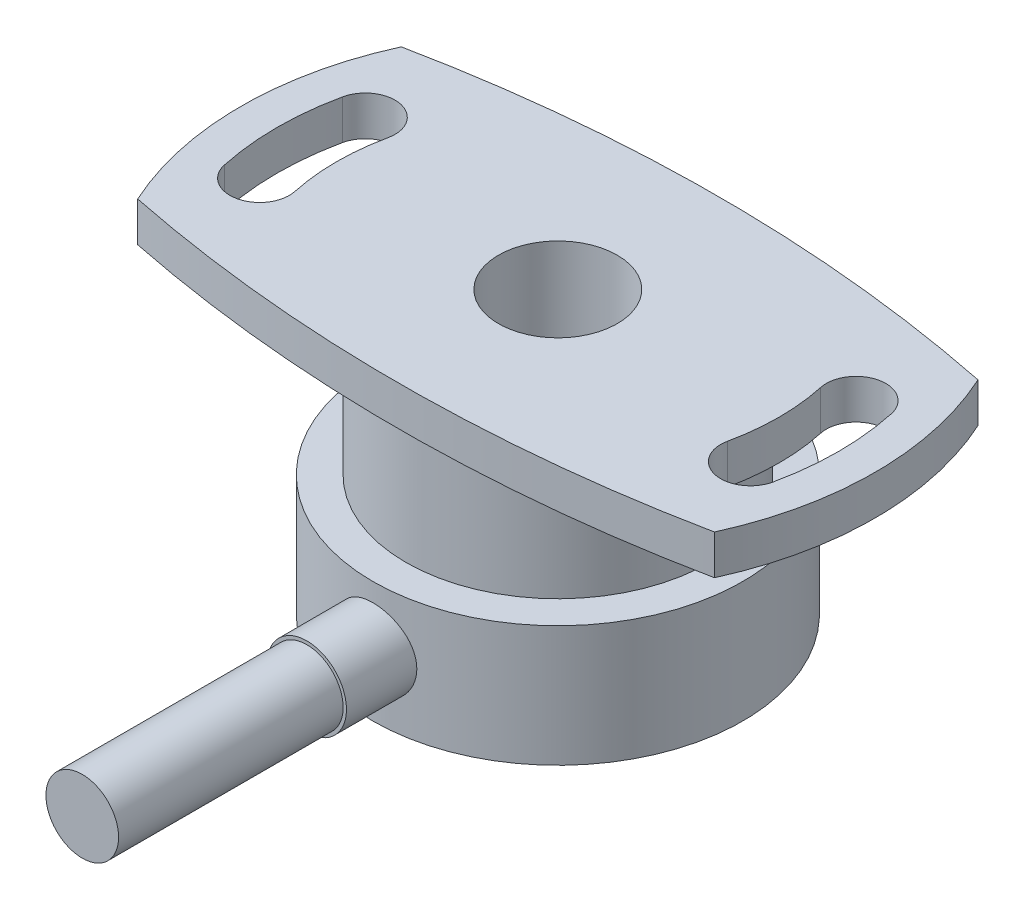
from build123d import *

# Parameters (mm, degrees)
SKETCH1_R           = 14
BOSS_EXTRUDE1_DEPTH = 9.15
SKETCH2_R           = 11.5
BOSS_EXTRUDE2_DEPTH = 9.15
BOSS_EXTRUDE3_DEPTH = 3
CUT_EXTRUDE1_START  = -3.000001
CUT_EXTRUDE1_DEPTH  = 3.000002
CUT_EXTRUDE2_DEPTH  = 36.009855755
SKETCH7_R           = 3
BOSS_EXTRUDE4_DEPTH = 19
SKETCH8_R           = 2.75
BOSS_EXTRUDE5_DEPTH = 17
SKETCH9_R           = 4.495
CUT_EXTRUDE3_DEPTH  = 49.225408241


with BuildPart() as part:
    # Sketch1 → Boss-Extrude1 (new body)
    with BuildSketch(Plane(origin=(0, 0, 0), x_dir=(1, 0, 0), z_dir=(0, 1, 0))):
        with Locations(Location((0, 0, 0), (0, 0, 270))):
            Circle(SKETCH1_R)
    extrude(amount=BOSS_EXTRUDE1_DEPTH)

    # Sketch2 → Boss-Extrude2 (add)
    with BuildSketch(Plane(origin=(0, 9.15, 0), x_dir=(1, 0, 0), z_dir=(0, 1, 0))):
        with Locations(Location((0, 0, 0), (0, 0, 270))):
            Circle(SKETCH2_R)
    extrude(amount=BOSS_EXTRUDE2_DEPTH)

    # Sketch3 → Boss-Extrude3 (add)
    with BuildSketch(Plane(origin=(0, 18.3, 0), x_dir=(1, 0, 0), z_dir=(0, 1, 0))):
        with BuildLine():
            Line((-20.684849103, -12.171155146), (20.684849103, -12.171155146))
            ThreePointArc((20.684849103, -12.171155146), (24, 0), (20.684849103, 12.171155146))
            Line((20.684849103, 12.171155146), (-20.684849103, 12.171155146))
            ThreePointArc((-20.684849103, 12.171155146), (-24, 0), (-20.684849103, -12.171155146))
        make_face()
    extrude(amount=BOSS_EXTRUDE3_DEPTH)

    # Sketch4 → Cut-Extrude1 (cut)
    with BuildSketch(Plane(origin=(0, 21.3, 0), x_dir=(1, 0, 0), z_dir=(0, 1, 0)).offset(CUT_EXTRUDE1_START)):
        with BuildLine():
            Line((-21.82865512, -9.975460673), (-21.82865512, -23.828437081))
            Line((-21.82865512, -23.828437081), (21.82865512, -23.828437081))
            Line((21.82865512, -23.828437081), (21.82865512, -9.975460673))
            ThreePointArc((21.82865512, -9.975460673), (0, -12.171155146), (-21.82865512, -9.975460673))
        make_face()
        with BuildLine():
            Line((21.82865512, 9.975460673), (21.82865512, 24.795204082))
            Line((21.82865512, 24.795204082), (-21.82865512, 24.795204082))
            Line((-21.82865512, 24.795204082), (-21.82865512, 9.975460673))
            ThreePointArc((-21.82865512, 9.975460673), (0, 12.171155146), (21.82865512, 9.975460673))
        make_face()
    extrude(amount=CUT_EXTRUDE1_DEPTH, mode=Mode.SUBTRACT)

    # Sketch6 → Cut-Extrude2 (cut, through all)
    with BuildSketch(Plane(origin=(0, 21.3, 0), x_dir=(1, 0, 0), z_dir=(0, 1, 0))):
        with BuildLine():
            ThreePointArc((-20.773998678, 4.472524896), (-21.25, 0), (-20.773998678, -4.472524896))
            ThreePointArc((-20.773998678, -4.472524896), (-18.100837358, -6.198563297), (-16.374798958, -3.525401977))
            ThreePointArc((-16.374798958, -3.525401977), (-16.75, 0), (-16.374798958, 3.525401977))
            ThreePointArc((-16.374798958, 3.525401977), (-18.100837358, 6.198563297), (-20.773998678, 4.472524896))
        make_face()
    cut_extrude2 = extrude(amount=-CUT_EXTRUDE2_DEPTH, mode=Mode.SUBTRACT)

    # Mirror1: Cut-Extrude2 across plane
    add(cut_extrude2.mirror(Plane(origin=(0, 0, 0), x_dir=(0, 0, 1), z_dir=(1, 0, 0))), mode=Mode.SUBTRACT)

    # Sketch7 → Boss-Extrude4 (add)
    with BuildSketch(Plane.XY):
        with Locations(Location((0, 4.762483919, 0), (0, 0, 180))):
            Circle(SKETCH7_R)
    extrude(amount=BOSS_EXTRUDE4_DEPTH)

    # Sketch8 → Boss-Extrude5 (add)
    with BuildSketch(Plane.XY.offset(19)):
        with Locations((0, 4.762483919)):
            Circle(SKETCH8_R)
    extrude(amount=BOSS_EXTRUDE5_DEPTH)

    # Sketch9 → Cut-Extrude3 (cut, through all)
    with BuildSketch(Plane.XZ):
        with Locations(Location((0, 0, 0), (0, 0, 270))):
            Circle(SKETCH9_R)
    extrude(amount=-CUT_EXTRUDE3_DEPTH, mode=Mode.SUBTRACT)


solid = part.part
